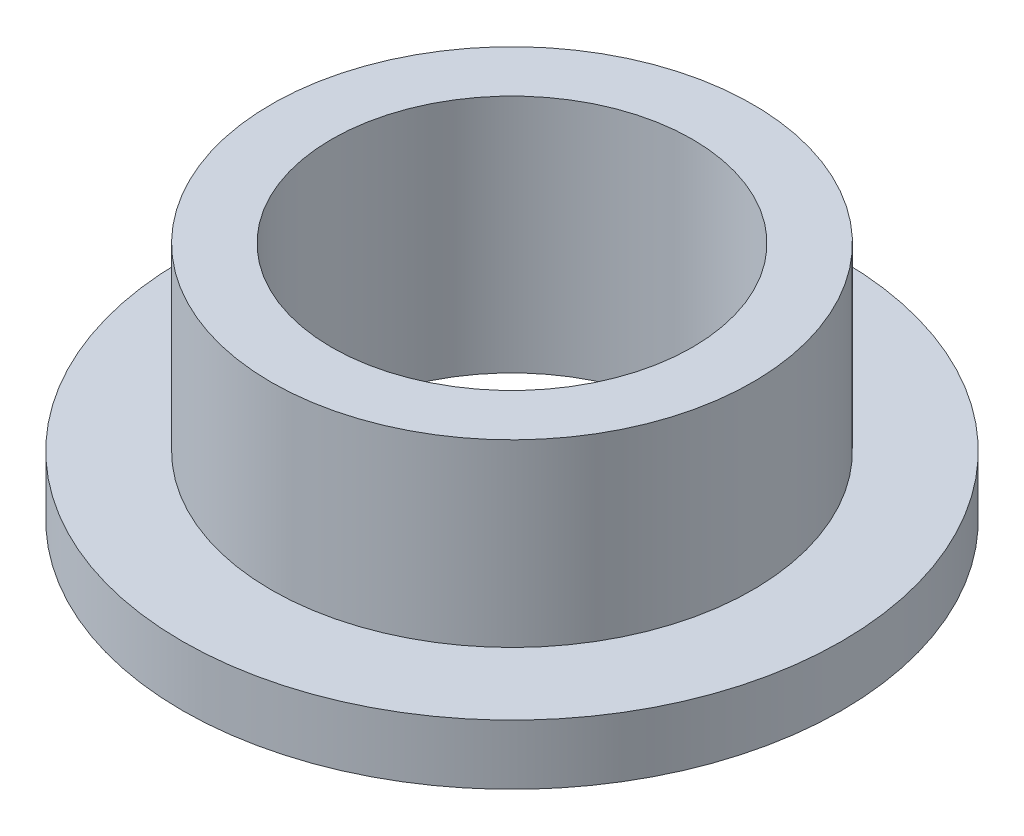
from build123d import *

# Parameters (mm, degrees)
SKETCH2_R           = 6.3754
SKETCH2_R_2         = 4.7752
BOSS_EXTRUDE1_DEPTH = 6.35
SKETCH3_R           = 8.73125
SKETCH3_R_2         = 6.3754
BOSS_EXTRUDE2_DEPTH = 1.5875


with BuildPart() as part:
    # Sketch2 → Boss-Extrude1 (new body)
    with BuildSketch(Plane(origin=(0, 0, 0), x_dir=(1, 0, 0), z_dir=(0, 1, 0))):
        with Locations(Location((0, 0, 0), (0, 0, 270))):
            Circle(SKETCH2_R)
        with Locations(Location((0, 0, 0), (0, 0, 270))):
            Circle(SKETCH2_R_2, mode=Mode.SUBTRACT)
    extrude(amount=BOSS_EXTRUDE1_DEPTH)

    # Sketch3 → Boss-Extrude2 (add)
    with BuildSketch(Plane(origin=(0, 0, 0), x_dir=(1, 0, 0), z_dir=(0, 1, 0))):
        with Locations(Location((0, 0, 0), (0, 0, 270))):
            Circle(SKETCH3_R)
        with Locations(Location((0, 0, 0), (0, 0, 270))):
            Circle(SKETCH3_R_2, mode=Mode.SUBTRACT)
    extrude(amount=BOSS_EXTRUDE2_DEPTH)


solid = part.part
